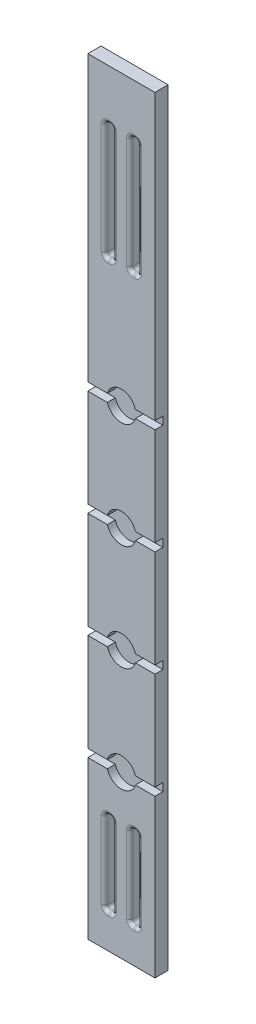
from build123d import *

# Parameters (mm, degrees)
SKETCH1_W           = 25.4
SKETCH1_H           = 290
SKETCH1_W_2         = 3.175
SKETCH1_H_2         = 44.45
SKETCH1_H_3         = 31.75
BOSS_EXTRUDE1_DEPTH = 5
FILLET1_R           = 1.27
CUT_EXTRUDE1_DEPTH  = 3.000000096


with BuildPart() as part:
    # Sketch1 → Boss-Extrude1 (new body)
    with BuildSketch(Plane.XY):
        with Locations((12.7, 145)):
            Rectangle(SKETCH1_W, SKETCH1_H)
        with Locations((7.9375, 248.725)):
            Rectangle(SKETCH1_W_2, SKETCH1_H_2, mode=Mode.SUBTRACT)
        with Locations((17.4625, 248.725)):
            Rectangle(SKETCH1_W_2, SKETCH1_H_2, mode=Mode.SUBTRACT)
        with Locations((7.9375, 28.575)):
            Rectangle(SKETCH1_W_2, SKETCH1_H_3, mode=Mode.SUBTRACT)
        with Locations((17.4625, 28.575)):
            Rectangle(SKETCH1_W_2, SKETCH1_H_3, mode=Mode.SUBTRACT)
    extrude(amount=BOSS_EXTRUDE1_DEPTH)

    # Fillet1
    fillet1_edges = [part.edges().sort_by_distance(p)[0] for p in [
        (6.35, 248.725, 0),
        (6.35, 270.95, 2.5),
        (7.9375, 226.5, 0),
        (6.35, 226.5, 2.5),
        (9.525, 248.725, 0),
        (9.525, 226.5, 2.5),
        (7.9375, 270.95, 0),
        (9.525, 270.95, 2.5),
        (6.35, 248.725, 5),
        (7.9375, 226.5, 5),
        (9.525, 248.725, 5),
        (7.9375, 270.95, 5),
        (15.875, 248.725, 0),
        (15.875, 270.95, 2.5),
        (17.4625, 226.5, 0),
        (15.875, 226.5, 2.5),
        (19.05, 248.725, 0),
        (19.05, 226.5, 2.5),
        (17.4625, 270.95, 0),
        (19.05, 270.95, 2.5),
        (15.875, 248.725, 5),
        (17.4625, 226.5, 5),
        (19.05, 248.725, 5),
        (17.4625, 270.95, 5),
        (15.875, 28.575, 0),
        (15.875, 44.45, 2.5),
        (17.4625, 12.7, 0),
        (15.875, 12.7, 2.5),
        (19.05, 28.575, 0),
        (19.05, 12.7, 2.5),
        (17.4625, 44.45, 0),
        (19.05, 44.45, 2.5),
        (15.875, 28.575, 5),
        (17.4625, 12.7, 5),
        (19.05, 28.575, 5),
        (17.4625, 44.45, 5),
        (6.35, 28.575, 0),
        (6.35, 44.45, 2.5),
        (7.9375, 12.7, 0),
        (6.35, 12.7, 2.5),
        (9.525, 28.575, 0),
        (9.525, 12.7, 2.5),
        (7.9375, 44.45, 0),
        (9.525, 44.45, 2.5),
        (6.35, 28.575, 5),
        (7.9375, 12.7, 5),
        (9.525, 28.575, 5),
        (7.9375, 44.45, 5),
    ]]
    fillet(fillet1_edges, radius=FILLET1_R)

    # Sketch2 → Cut-Extrude1 (cut)
    with BuildSketch(Plane.XY.offset(5)):
        with BuildLine():
            Line((17.991502622, 182.5), (25.4, 182.5))
            Line((25.4, 182.5), (25.4, 179.5))
            Line((25.4, 179.5), (17.991502622, 179.5))
            ThreePointArc((17.991502622, 179.5), (12.7, 175.5), (7.408497378, 179.5))
            Line((7.408497378, 179.5), (0, 179.5))
            Line((0, 179.5), (0, 182.5))
            Line((0, 182.5), (7.408497378, 182.5))
            ThreePointArc((7.408497378, 182.5), (12.7, 186.5), (17.991502622, 182.5))
        make_face()
        with BuildLine():
            Line((17.991502622, 142.5000038), (25.4, 142.5000038))
            Line((25.4, 142.5000038), (25.4, 139.5000038))
            Line((25.4, 139.5000038), (17.991502622, 139.5000038))
            ThreePointArc((17.991502622, 139.5000038), (12.7, 135.5000038), (7.408497378, 139.5000038))
            Line((7.408497378, 139.5000038), (0, 139.5000038))
            Line((0, 139.5000038), (0, 142.5000038))
            Line((0, 142.5000038), (7.408497378, 142.5000038))
            ThreePointArc((7.408497378, 142.5000038), (12.7, 146.5000038), (17.991502622, 142.5000038))
        make_face()
        with BuildLine():
            Line((17.991502622, 102.5000076), (25.4, 102.5000076))
            Line((25.4, 102.5000076), (25.4, 99.5000076))
            Line((25.4, 99.5000076), (17.991502622, 99.5000076))
            ThreePointArc((17.991502622, 99.5000076), (12.7, 95.5000076), (7.408497378, 99.5000076))
            Line((7.408497378, 99.5000076), (0, 99.5000076))
            Line((0, 99.5000076), (0, 102.5000076))
            Line((0, 102.5000076), (7.408497378, 102.5000076))
            ThreePointArc((7.408497378, 102.5000076), (12.7, 106.5000076), (17.991502622, 102.5000076))
        make_face()
        with BuildLine():
            Line((17.991502622, 62.5000114), (25.4, 62.5000114))
            Line((25.4, 62.5000114), (25.4, 59.5000114))
            Line((25.4, 59.5000114), (17.991502622, 59.5000114))
            ThreePointArc((17.991502622, 59.5000114), (12.7, 55.5000114), (7.408497378, 59.5000114))
            Line((7.408497378, 59.5000114), (0, 59.5000114))
            Line((0, 59.5000114), (0, 62.5000114))
            Line((0, 62.5000114), (7.408497378, 62.5000114))
            ThreePointArc((7.408497378, 62.5000114), (12.7, 66.5000114), (17.991502622, 62.5000114))
        make_face()
    extrude(amount=-CUT_EXTRUDE1_DEPTH, mode=Mode.SUBTRACT)


solid = part.part
